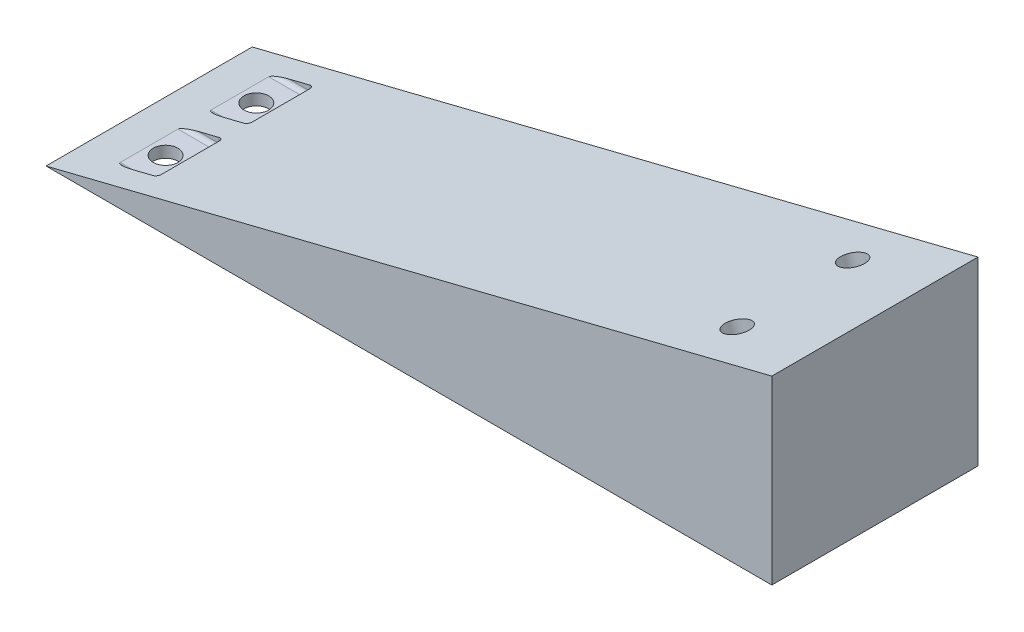
from build123d import *

# Parameters (mm, degrees)
EXTRUDE_1_DEPTH     = 25
SKETCH_2_R          = 1.5
CUT_EXTRUDE_1_DEPTH = 8
SKETCH_3_R          = 1.5
CUT_EXTRUDE_2_DEPTH = 8
CUT_EXTRUDE_3_DEPTH = 8
SKETCH_6_R          = 1.5
CUT_EXTRUDE_4_DEPTH = 94.766234905
FILLET_1_R          = 0.5


with BuildPart() as part:
    # 草图1 → 凸台-拉伸1 (new body)
    with BuildSketch(Plane.XY):
        Polygon((0, 0), (-88, 0), (0, 21.94086425), align=None)
    extrude(amount=EXTRUDE_1_DEPTH)

    # 草图2 → 切除-拉伸1 (cut)
    with BuildSketch(Plane.XZ):
        with Locations(Location((-7.5, 19.5, 0), (0, 0, 270))):
            Circle(SKETCH_2_R)
        with Locations(Location((-7.5, 5.5, 0), (0, 0, 90))):
            Circle(SKETCH_2_R)
    extrude(amount=-CUT_EXTRUDE_1_DEPTH, mode=Mode.SUBTRACT)

    # 草图3 → 切除-拉伸2 (cut)
    with BuildSketch(Plane(origin=(-5.150305914, 20.656748763, 0), x_dir=(0.9702957262759981, 0.24192189559966132, 0), z_dir=(-0.2419218955996613, 0.970295726275998, 0))):
        with Locations(Location((-4.692024529, -5.5, 0), (0, 0, 180))):
            Circle(SKETCH_3_R)
        with Locations(Location((-4.692024529, -19.5, 0), (0, 0, 180))):
            Circle(SKETCH_3_R)
    extrude(amount=-CUT_EXTRUDE_2_DEPTH, mode=Mode.SUBTRACT)

    # 草图5 → 切除-拉伸3 (cut)
    with BuildSketch(Plane.XY.offset(22)):
        Polygon((-77.5, 1.371304016), (-77.5, 2.61794403), (-82.5, 1.371304016), align=None)
    cut_extrude_3 = extrude(amount=-CUT_EXTRUDE_3_DEPTH, mode=Mode.SUBTRACT)

    # 草图6 → 切除-拉伸4 (cut, through all)
    with BuildSketch(Plane(origin=(0, 1.371304016, 0), x_dir=(1, 0, 0), z_dir=(0, 1, 0))):
        with Locations(Location((-80.5, -18, 0), (0, 0, 180))):
            Circle(SKETCH_6_R)
    cut_extrude_4 = extrude(amount=-CUT_EXTRUDE_4_DEPTH, mode=Mode.SUBTRACT)

    # 镜向1: 切除-拉伸3, 切除-拉伸4 across plane
    add(cut_extrude_3.mirror(Plane.XY.offset(12.5)), mode=Mode.SUBTRACT)
    add(cut_extrude_4.mirror(Plane.XY.offset(12.5)), mode=Mode.SUBTRACT)

    # 圆角1
    fillet_1_edges = [part.edges().sort_by_distance(p)[0] for p in [
        (-80, 1.371304016, 14),
        (-77.5, 1.371304016, 18),
        (-77.5, 1.994624023, 14),
        (-80, 1.371304016, 22),
        (-77.5, 1.994624023, 22),
        (-80, 1.371304016, 3),
        (-77.5, 1.994624023, 3),
        (-77.5, 1.371304016, 7),
        (-80, 1.371304016, 11),
        (-77.5, 1.994624023, 11),
    ]]
    fillet(fillet_1_edges, radius=FILLET_1_R)


solid = part.part
